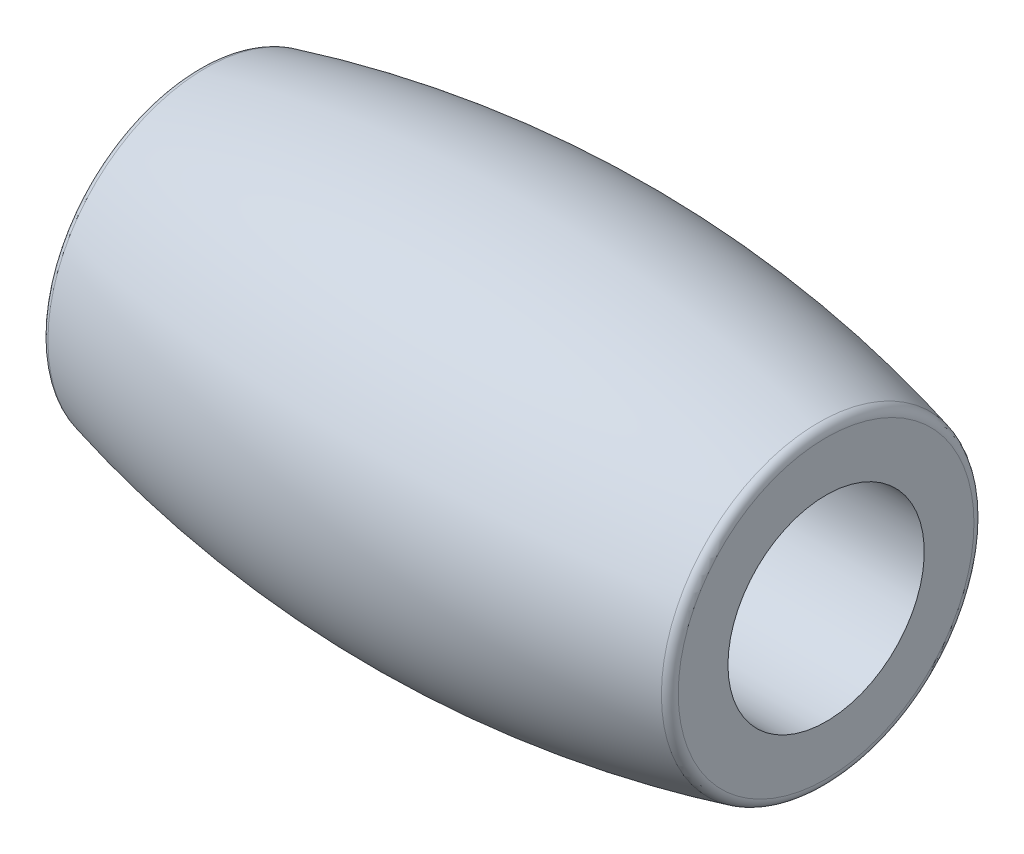
from build123d import *

# Parameters (mm, degrees)
FILLET1_R = 0.5


with BuildPart() as part:
    # Sketch1 → Revolve2 (revolve)
    with BuildSketch(Plane.XY, mode=Mode.PRIVATE) as revolve2_sk:
        with BuildLine():
            Line((16, 57.5), (16, 60.417298847))
            ThreePointArc((16, 60.417298847), (0, 62.5), (-16, 60.417298847))
            Line((-16, 60.417298847), (-16, 57.5))
            Line((-16, 57.5), (16, 57.5))
        make_face()
    revolve(revolve2_sk.sketch.rotate(Axis((-16, 52.5, 0), (1, 0, 0)), 90), axis=Axis((-16, 52.5, 0), (1, 0, 0)))

    # Fillet1
    fillet1_edges = [part.edges().sort_by_distance(p)[0] for p in [
        (16, 52.5, -7.917298847),
        (-16, 52.5, -7.917298847),
    ]]
    fillet(fillet1_edges, radius=FILLET1_R)


solid = part.part
